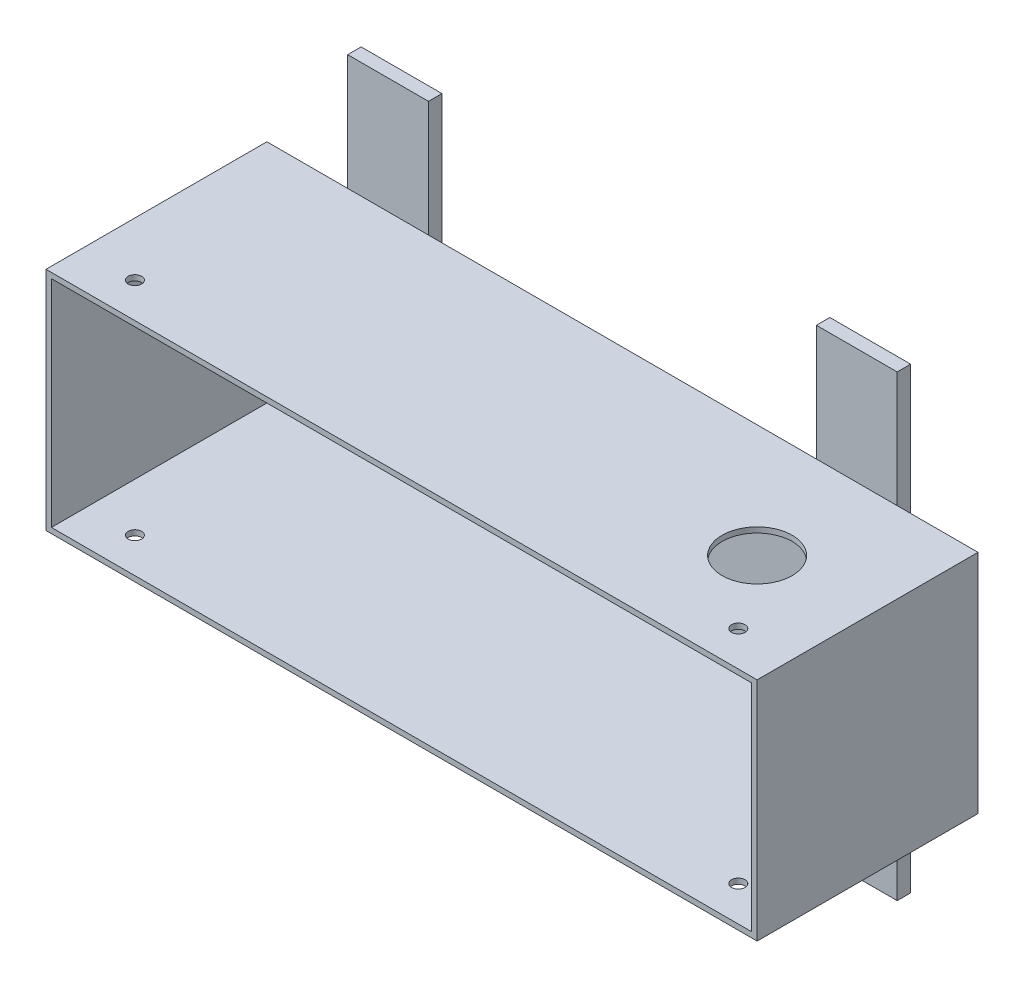
from build123d import *

# Parameters (mm, degrees)
SKETCH1_W           = 260
SKETCH1_H           = 80
BOSS_EXTRUDE1_DEPTH = 80
SHELL1_T            = 2
SKETCH3_W           = 30
SKETCH3_H           = 170
BOSS_EXTRUDE2_DEPTH = 5
SKETCH4_R           = 5
CUT_EXTRUDE3_DEPTH  = 7
SKETCH6_R           = 13
CUT_EXTRUDE4_DEPTH  = 2
SKETCH7_R           = 2.5
CUT_EXTRUDE5_DEPTH  = 82


with BuildPart() as part:
    # Sketch1 → Boss-Extrude1 (new body)
    with BuildSketch(Plane.XY):
        with Locations((130, 40)):
            Rectangle(SKETCH1_W, SKETCH1_H)
    extrude(amount=BOSS_EXTRUDE1_DEPTH)

    # Shell1
    shell1_openings = [part.faces().sort_by_distance(p)[0] for p in [
        (130, 40, 80),
    ]]
    offset(amount=SHELL1_T, openings=shell1_openings, kind=Kind.INTERSECTION)

    # Sketch3 → Boss-Extrude2 (add)
    with BuildSketch(Plane(origin=(0, 0, -2), x_dir=(-1, 0, 0), z_dir=(0, 0, -1))):
        with Locations((-217, 40)):
            Rectangle(SKETCH3_W, SKETCH3_H)
        with Locations((-43, 40)):
            Rectangle(SKETCH3_W, SKETCH3_H)
    extrude(amount=BOSS_EXTRUDE2_DEPTH)

    # Sketch4 → Cut-Extrude3 (cut)
    with BuildSketch(Plane(origin=(0, 0, -7), x_dir=(-1, 0, 0), z_dir=(0, 0, -1))):
        with Locations((-217, 66)):
            Circle(SKETCH4_R)
        with Locations((-217, 14)):
            Circle(SKETCH4_R)
    cut_extrude3 = extrude(amount=-CUT_EXTRUDE3_DEPTH, mode=Mode.SUBTRACT)

    # Mirror1: Cut-Extrude3 across plane
    add(cut_extrude3.mirror(Plane(origin=(130, 0, 0), x_dir=(0, 0, 1), z_dir=(1, 0, 0))), mode=Mode.SUBTRACT)

    # Sketch6 → Cut-Extrude4 (cut)
    with BuildSketch(Plane(origin=(0, 82, 0), x_dir=(1, 0, 0), z_dir=(0, 1, 0))):
        with Locations(Location((222, -40, 0), (0, 0, 270))):
            Circle(SKETCH6_R)
    extrude(amount=-CUT_EXTRUDE4_DEPTH, mode=Mode.SUBTRACT)

    # Sketch7 → Cut-Extrude5 (cut)
    with BuildSketch(Plane(origin=(0, 82, 0), x_dir=(1, 0, 0), z_dir=(0, 1, 0))):
        with Locations(Location((18, -67, 0), (0, 0, 270))):
            Circle(SKETCH7_R)
        with Locations(Location((242, -67, 0), (0, 0, 270))):
            Circle(SKETCH7_R)
    cut_extrude5 = extrude(amount=-CUT_EXTRUDE5_DEPTH, mode=Mode.SUBTRACT)

    # Mirror2: Cut-Extrude5 across plane
    add(cut_extrude5.mirror(Plane(origin=(0, 40, 0), x_dir=(0, 0, 1), z_dir=(0, -1, 0))), mode=Mode.SUBTRACT)


solid = part.part
